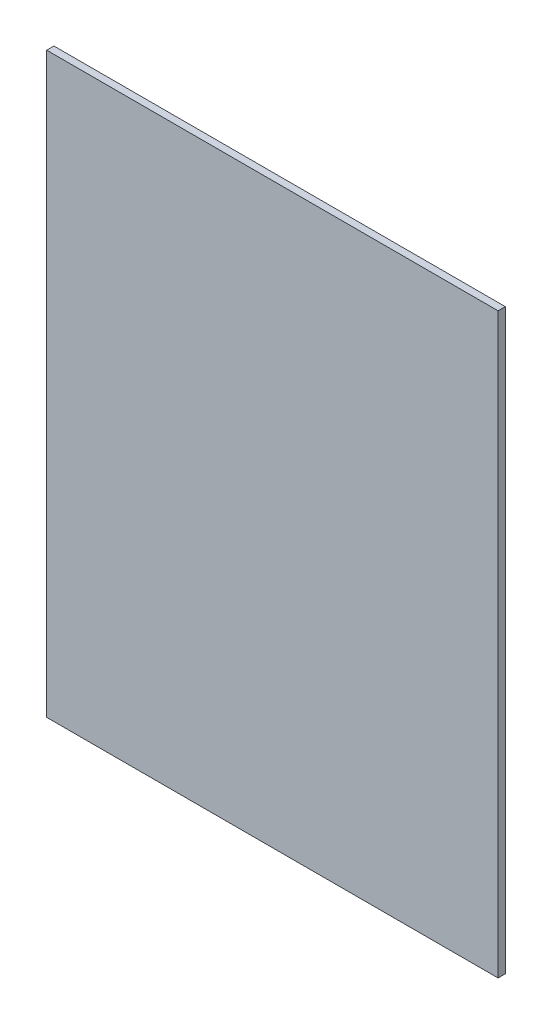
from build123d import *

# Parameters (mm, degrees)
SKETCH1_W           = 250
SKETCH1_H           = 320
BOSS_EXTRUDE1_DEPTH = 4


with BuildPart() as part:
    # Sketch1 → Boss-Extrude1 (new body)
    with BuildSketch(Plane.XY.offset(-54.224909152)):
        with Locations((-20, -20)):
            Rectangle(SKETCH1_W, SKETCH1_H)
    extrude(amount=-BOSS_EXTRUDE1_DEPTH)


solid = part.part
